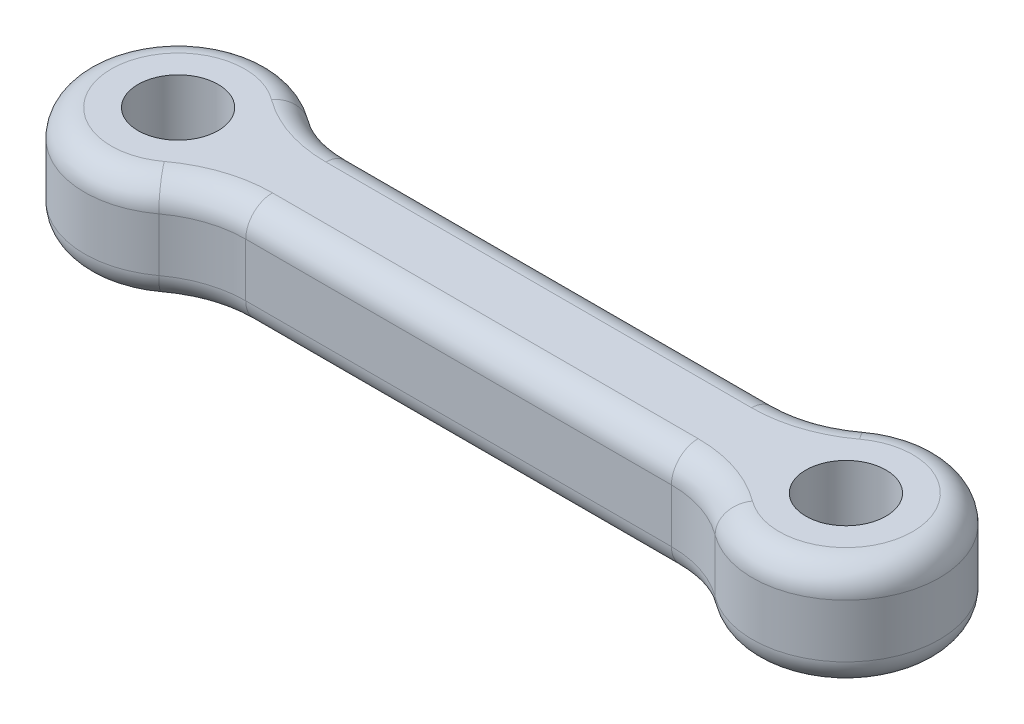
from build123d import *

# Parameters (mm, degrees)
SKETCH2_R           = 1.5
BOSS_EXTRUDE1_DEPTH = 4
FILLET1_R           = 1


with BuildPart() as part:
    # Sketch2 → Boss-Extrude1 (new body)
    with BuildSketch(Plane(origin=(0, 0, 0), x_dir=(1, 0, 0), z_dir=(0, 1, 0))):
        with BuildLine():
            Line((4.532848985, -2), (20.467151015, -2))
            ThreePointArc((20.467151015, -2), (21.754875946, -2.207531543), (22.9122034, -2.809111133))
            ThreePointArc((22.9122034, -2.809111133), (28.5, 0), (22.9122034, 2.809111133))
            ThreePointArc((22.9122034, 2.809111133), (21.754875946, 2.207531543), (20.467151015, 2))
            Line((20.467151015, 2), (4.532848985, 2))
            ThreePointArc((4.532848985, 2), (3.245124054, 2.207531543), (2.0877966, 2.809111133))
            ThreePointArc((2.0877966, 2.809111133), (-3.5, 0), (2.0877966, -2.809111133))
            ThreePointArc((2.0877966, -2.809111133), (3.245124054, -2.207531543), (4.532848985, -2))
        make_face()
        with Locations(Location((0, 0, 0), (0, 0, 270))):
            Circle(SKETCH2_R, mode=Mode.SUBTRACT)
        with Locations(Location((25, 0, 0), (0, 0, 90))):
            Circle(SKETCH2_R, mode=Mode.SUBTRACT)
    extrude(amount=BOSS_EXTRUDE1_DEPTH)

    # Fillet1
    fillet1_edges = [part.edges().sort_by_distance(p)[0] for p in [
        (21.754875946, 4, 2.207531543),
        (12.5, 0, 2),
        (3.245124054, 0, 2.207531543),
        (28.5, 4, 0),
        (21.754875946, 4, -2.207531543),
        (12.5, 4, -2),
        (3.245124054, 4, -2.207531543),
        (-3.5, 4, 0),
        (3.245124054, 4, 2.207531543),
        (12.5, 4, 2),
        (-3.5, 0, 0),
        (3.245124054, 0, -2.207531543),
        (12.5, 0, -2),
        (21.754875946, 0, -2.207531543),
        (28.5, 0, 0),
        (21.754875946, 0, 2.207531543),
    ]]
    fillet(fillet1_edges, radius=FILLET1_R)


solid = part.part
